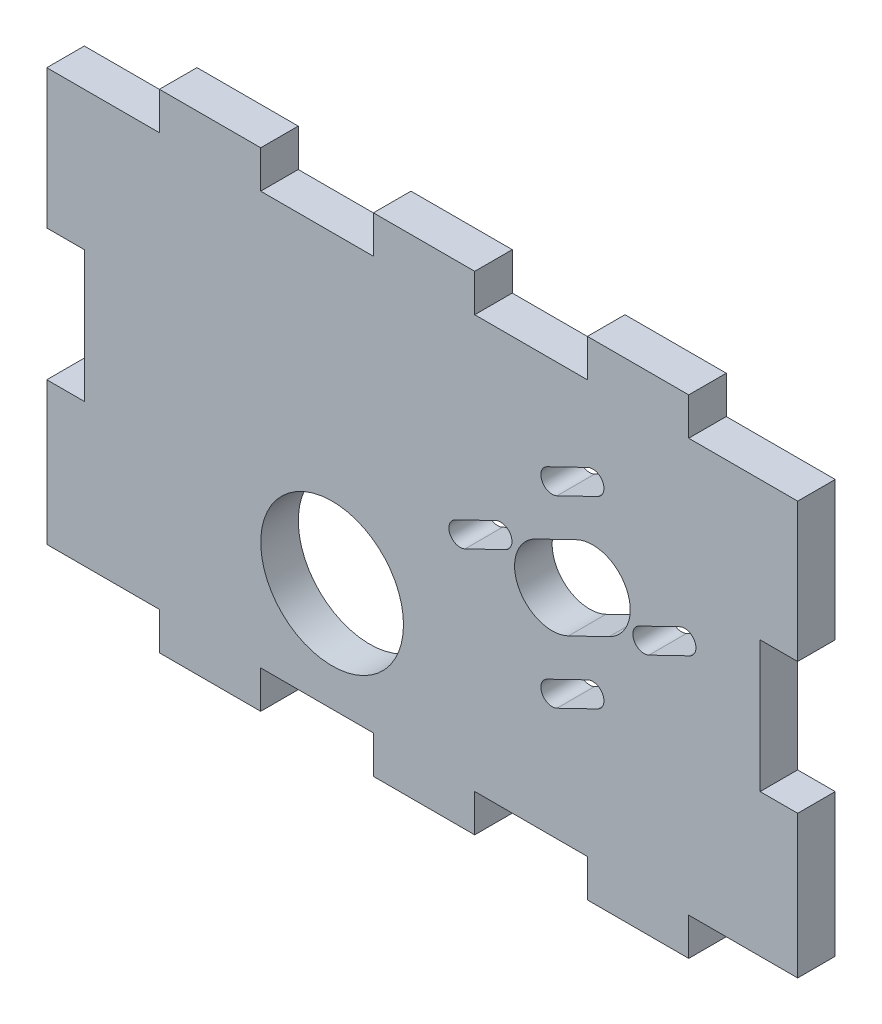
from build123d import *

# Parameters (mm, degrees)
ESQUISSE1_W             = 100
ESQUISSE1_H             = 65
BOSS_EXTRU_1_DEPTH      = 5
ESQUISSE2_W             = 15
ESQUISSE2_H             = 5.01
ESQUISSE2_W_2           = 15.01
ESQUISSE2_W_3           = 14.51
ESQUISSE2_H_2           = 5
ESQUISSE2_W_4           = 5
ESQUISSE2_H_3           = 17.5
ENL_V_MAT_EXTRU_1_DEPTH = 5
ESQUISSE7_R             = 9.505
ENL_V_MAT_EXTRU_5_DEPTH = 10
ENL_V_MAT_EXTRU_6_DEPTH = 10


with BuildPart() as part:
    # Esquisse1 → Boss.-Extru.1 (new body)
    with BuildSketch(Plane.XY):
        Rectangle(ESQUISSE1_W, ESQUISSE1_H)
    extrude(amount=BOSS_EXTRU_1_DEPTH)

    # Esquisse2 → Enlèv. mat.-Extru.1 (cut)
    with BuildSketch(Plane.XY.offset(5)):
        with Locations((-42.5, 29.995)):
            Rectangle(ESQUISSE2_W, ESQUISSE2_H)
        with Locations((-14.005, 29.995)):
            Rectangle(ESQUISSE2_W_2, ESQUISSE2_H)
        with Locations((14.495, 29.995)):
            Rectangle(ESQUISSE2_W_2, ESQUISSE2_H)
        with Locations((42.745, 30)):
            Rectangle(ESQUISSE2_W_3, ESQUISSE2_H_2)
        with Locations((-47.5, 0.25)):
            Rectangle(ESQUISSE2_W_4, ESQUISSE2_H_3)
        with Locations((47.5, 0.25)):
            Rectangle(ESQUISSE2_W_4, ESQUISSE2_H_3)
        with Locations((42.745, -30)):
            Rectangle(ESQUISSE2_W_3, ESQUISSE2_H_2)
        with Locations((14.495, -29.995)):
            Rectangle(ESQUISSE2_W_2, ESQUISSE2_H)
        with Locations((-14.005, -29.995)):
            Rectangle(ESQUISSE2_W_2, ESQUISSE2_H)
        with Locations((-42.5, -29.995)):
            Rectangle(ESQUISSE2_W, ESQUISSE2_H)
    extrude(amount=-ENL_V_MAT_EXTRU_1_DEPTH, mode=Mode.SUBTRACT)

    # Esquisse7 → Enlèv. mat.-Extru.5 (cut)
    with BuildSketch(Plane.XY.offset(5)):
        with Locations((-12, -13)):
            Circle(ESQUISSE7_R)
    extrude(amount=-ENL_V_MAT_EXTRU_5_DEPTH, mode=Mode.SUBTRACT)

    # Esquisse8 → Enlèv. mat.-Extru.6 (cut)
    with BuildSketch(Plane.XY.offset(5)):
        with BuildLine():
            Line((24.87958624, -0.692121258), (19.479698297, -3.30769198))
            ThreePointArc((19.479698297, -3.30769198), (12.800149409, -0.98742763), (15.12041376, 5.692121258))
            Line((15.12041376, 5.692121258), (20.520301703, 8.30769198))
            ThreePointArc((20.520301703, 8.30769198), (27.199850591, 5.98742763), (24.87958624, -0.692121258))
        make_face()
        with BuildLine():
            Line((23.353836652, 14.707813375), (17.953948709, 12.092242653))
            ThreePointArc((17.953948709, 12.092242653), (15.950084043, 12.788321958), (16.646163348, 14.792186625))
            Line((16.646163348, 14.792186625), (22.046051291, 17.407757347))
            ThreePointArc((22.046051291, 17.407757347), (24.049915957, 16.711678042), (23.353836652, 14.707813375))
        make_face()
        with BuildLine():
            Line((23.353836652, -9.792186625), (17.953948709, -12.407757347))
            ThreePointArc((17.953948709, -12.407757347), (15.950084043, -11.711678042), (16.646163348, -9.707813375))
            Line((16.646163348, -9.707813375), (22.046051291, -7.092242653))
            ThreePointArc((22.046051291, -7.092242653), (24.049915957, -7.788321958), (23.353836652, -9.792186625))
        make_face()
        with BuildLine():
            Line((11.103836652, 2.457813375), (5.703948709, -0.157757347))
            ThreePointArc((5.703948709, -0.157757347), (3.700084043, 0.538321958), (4.396163348, 2.542186625))
            Line((4.396163348, 2.542186625), (9.796051291, 5.157757347))
            ThreePointArc((9.796051291, 5.157757347), (11.799915957, 4.461678042), (11.103836652, 2.457813375))
        make_face()
        with BuildLine():
            Line((35.603836652, 2.457813375), (30.203948709, -0.157757347))
            ThreePointArc((30.203948709, -0.157757347), (28.200084043, 0.538321958), (28.896163348, 2.542186625))
            Line((28.896163348, 2.542186625), (34.296051291, 5.157757347))
            ThreePointArc((34.296051291, 5.157757347), (36.299915957, 4.461678042), (35.603836652, 2.457813375))
        make_face()
    extrude(amount=-ENL_V_MAT_EXTRU_6_DEPTH, mode=Mode.SUBTRACT)


solid = part.part
